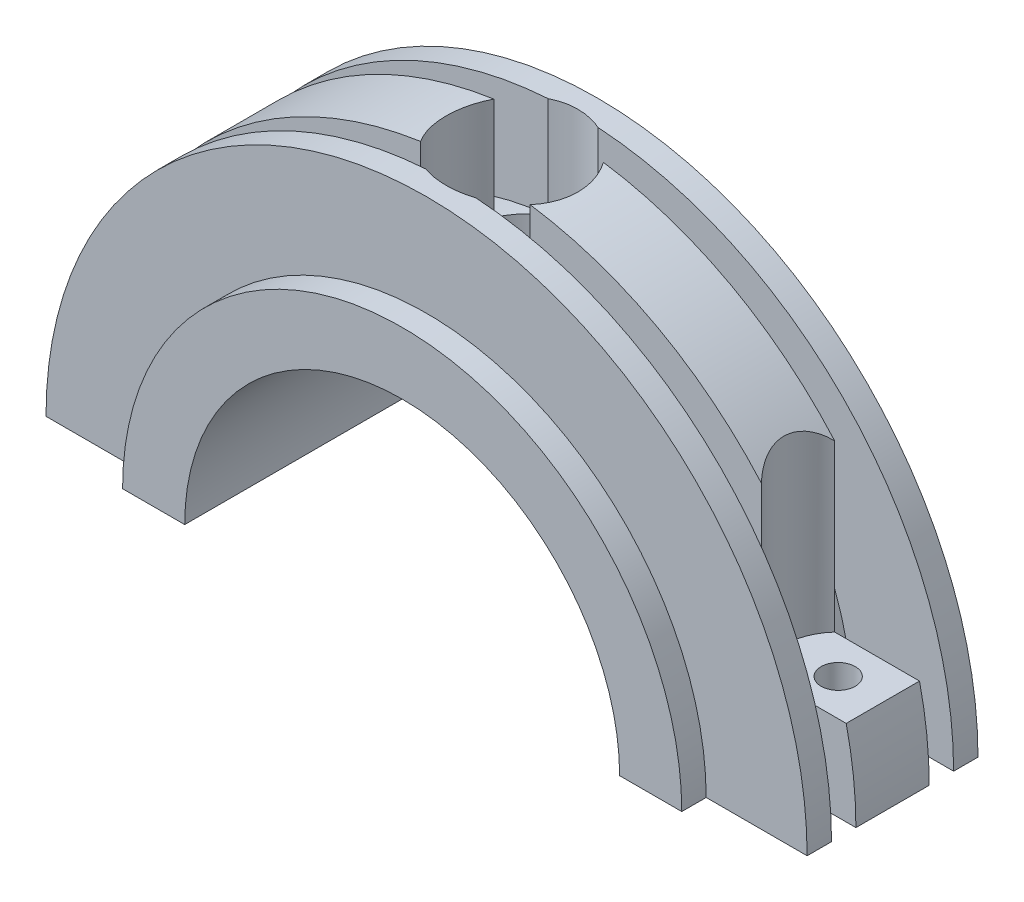
from build123d import *

# Parameters (mm, degrees)
CUT_EXTRUDE1_DEPTH = 38.422447809
CUT_EXTRUDE2_START = 5.5
CUT_EXTRUDE2_DEPTH = 32.922447809
SKETCH4_R          = 1.1
SKETCH4_R_2        = 4.245
CUT_EXTRUDE3_DEPTH = 38.422447874


with BuildPart() as part:
    # Sketch1 → Revolve1 (revolve)
    with BuildSketch(Plane(origin=(0, 0, 0), x_dir=(1, 0, 0), z_dir=(0, 1, 0)), mode=Mode.PRIVATE) as revolve1_sk:
        Polygon((-14, 0), (-14, 14.14), (-18, 14.14), (-18, 12.57), (-24.5, 12.57), (-24.5, 11), (-18, 11), (-18, 9.43), (-24.5, 9.43), (-24.5, 4.71), (-18, 4.71), (-18, 3.14), (-24.5, 3.14), (-24.5, 1.57), (-18, 1.57), (-18, 0), align=None)
    revolve(revolve1_sk.sketch.rotate(Axis((0, 0, 0), (0, 0, -1)), 180), axis=Axis((0, 0, 0), (0, 0, -1)))

    # Sketch2 → Cut-Extrude1 (cut, through all)
    with BuildSketch(Plane.XY):
        with BuildLine():
            Line((-24.5, 0), (24.5, 0))
            ThreePointArc((24.5, 0), (0, -24.5), (-24.5, 0))
        make_face()
    extrude(amount=-CUT_EXTRUDE1_DEPTH, mode=Mode.SUBTRACT)

    # Sketch3 → Cut-Extrude2 (cut, through all)
    with BuildSketch(Plane(origin=(0, 0, 0), x_dir=(1, 0, 0), z_dir=(0, 1, 0)).offset(CUT_EXTRUDE2_START)):
        with BuildLine():
            Line((-23.584646978, 9.43), (-24.5, 9.43))
            Line((-24.5, 9.43), (-24.5, 4.71))
            Line((-24.5, 4.71), (-23.584646978, 4.71))
            ThreePointArc((-23.584646978, 4.71), (-17.5, 7.07), (-23.584646978, 9.43))
        make_face()
        with BuildLine():
            Line((23.584646978, 4.71), (24.5, 4.71))
            Line((24.5, 4.71), (24.5, 9.43))
            Line((24.5, 9.43), (23.584646978, 9.43))
            ThreePointArc((23.584646978, 9.43), (17.5, 7.07), (23.584646978, 4.71))
        make_face()
    extrude(amount=CUT_EXTRUDE2_DEPTH, mode=Mode.SUBTRACT)

    # Sketch4 → Cut-Extrude3 (cut, through all)
    with BuildSketch(Plane.XZ):
        with Locations(Location((-21, -7.07, 0), (0, 0, 270))):
            Circle(SKETCH4_R)
        with Locations(Location((21, -7.07, 0), (0, 0, 270))):
            Circle(SKETCH4_R)
        with Locations(Location((0, -7.07, 0), (0, 0, 270))):
            Circle(SKETCH4_R_2)
    extrude(amount=-CUT_EXTRUDE3_DEPTH, mode=Mode.SUBTRACT)


solid = part.part
